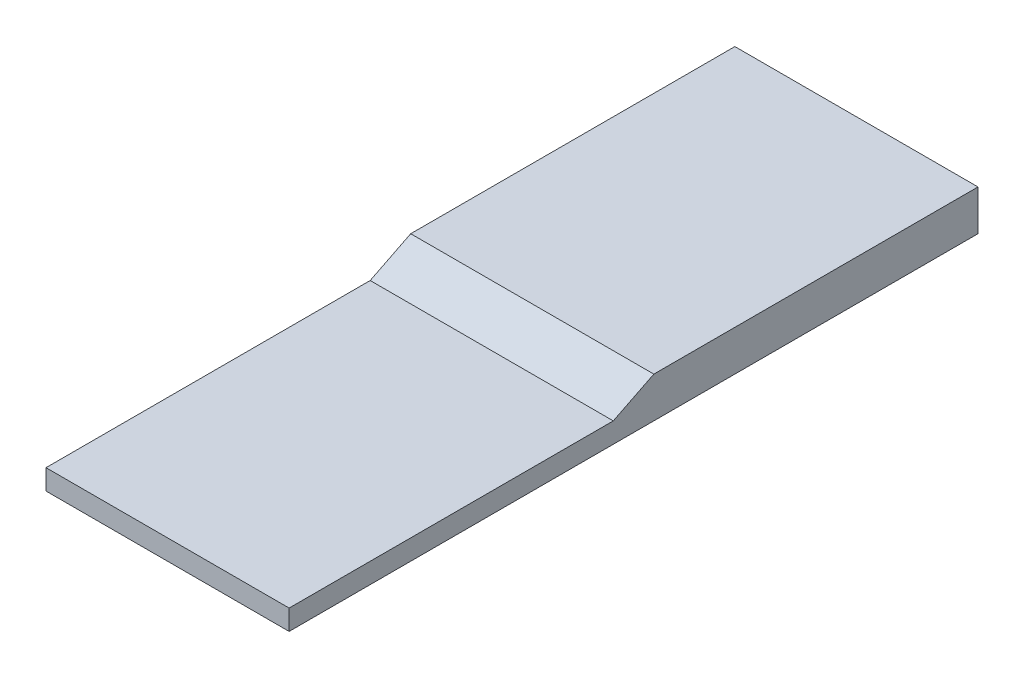
from build123d import *

# Parameters (mm, degrees)
BOSS_EXTRUDE1_DEPTH = 304.8


with BuildPart() as part:
    # Sketch1 → Boss-Extrude1 (new body)
    with BuildSketch(Plane(origin=(0, 0, 0), x_dir=(0, 0, -1), z_dir=(1, 0, 0))):
        Polygon((-406.4, 0), (0, 0), (50.8, 25.4), (457.2, 25.4), (457.2, -25.4), (-406.4, -25.4), align=None)
    extrude(amount=BOSS_EXTRUDE1_DEPTH)


solid = part.part
